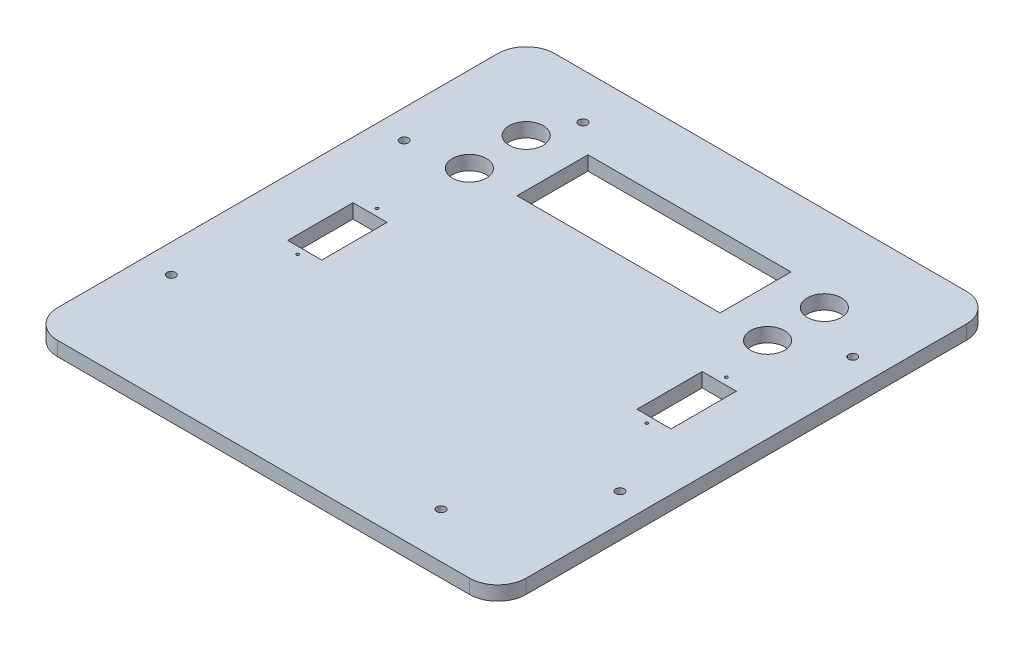
from build123d import *

# Parameters (mm, degrees)
RESSALTO_EXTRUS_O1_DEPTH = 5
ESBO_O2_R                = 1.5
CORTE_EXTRUS_O1_DEPTH    = 5
ESBO_O4_R                = 0.5
ESBO_O4_W                = 12
ESBO_O4_H                = 23
CORTE_EXTRUS_O3_DEPTH    = 193.467750623
ESBO_O5_R                = 1.5
ESBO_O5_W                = 71.5
ESBO_O5_H                = 25
CORTE_EXTRUS_O4_DEPTH    = 193.467750623
ESBO_O6_R                = 6
CORTE_EXTRUS_O5_DEPTH    = 193.467750623


with BuildPart() as part:
    # Esboço1 → Ressalto-extrusão1 (new body)
    with BuildSketch(Plane(origin=(0, 0, 0), x_dir=(1, 0, 0), z_dir=(0, 1, 0))):
        with BuildLine():
            Line((-25.463589741, 142.264378701), (119.536410259, 142.264378701))
            ThreePointArc((119.536410259, 142.264378701), (126.607478071, 139.335446513), (129.536410259, 132.264378701))
            Line((129.536410259, 132.264378701), (129.536410259, -22.735621299))
            ThreePointArc((129.536410259, -22.735621299), (126.607478071, -29.806689111), (119.536410259, -32.735621299))
            Line((119.536410259, -32.735621299), (-25.463589741, -32.735621299))
            ThreePointArc((-25.463589741, -32.735621299), (-32.534657553, -29.806689111), (-35.463589741, -22.735621299))
            Line((-35.463589741, -22.735621299), (-35.463589741, 132.264378701))
            ThreePointArc((-35.463589741, 132.264378701), (-32.534657553, 139.335446513), (-25.463589741, 142.264378701))
        make_face()
    extrude(amount=RESSALTO_EXTRUS_O1_DEPTH)

    # Esboço2 → Corte-extrusão1 (cut)
    with BuildSketch(Plane(origin=(0, 5, 0), x_dir=(1, 0, 0), z_dir=(0, 1, 0))):
        with Locations(Location((-25.463589741, 7.264378701, 0), (0, 0, 270))):
            Circle(ESBO_O2_R)
        with Locations(Location((0.536410259, 126.264378701, 0), (0, 0, 270))):
            Circle(ESBO_O2_R)
        with Locations(Location((119.536410259, 102.264378701, 0), (0, 0, 270))):
            Circle(ESBO_O2_R)
        with Locations(Location((93.536410259, -16.735621299, 0), (0, 0, 270))):
            Circle(ESBO_O2_R)
    extrude(amount=-CORTE_EXTRUS_O1_DEPTH, mode=Mode.SUBTRACT)

    # Esboço4 → Corte-extrusão3 (cut, through all)
    with BuildSketch(Plane(origin=(0, 5, 0), x_dir=(1, 0, 0), z_dir=(0, 1, 0))):
        with Locations(Location((-9.463589741, 35.764378701, 0), (0, 0, 270))):
            Circle(ESBO_O4_R)
        with Locations(Location((-9.463589741, 63.764378701, 0), (0, 0, 270))):
            Circle(ESBO_O4_R)
        with Locations(Location((103.536410259, 45.764378701, 0), (0, 0, 270))):
            Circle(ESBO_O4_R)
        with Locations(Location((103.536410259, 73.764378701, 0), (0, 0, 270))):
            Circle(ESBO_O4_R)
        with Locations((-9.463589741, 49.764378701)):
            Rectangle(ESBO_O4_W, ESBO_O4_H)
        with Locations((103.536410259, 59.764378701)):
            Rectangle(ESBO_O4_W, ESBO_O4_H)
    extrude(amount=-CORTE_EXTRUS_O3_DEPTH, mode=Mode.SUBTRACT)

    # Esboço5 → Corte-extrusão4 (cut, through all)
    with BuildSketch(Plane(origin=(0, 5, 0), x_dir=(1, 0, 0), z_dir=(0, 1, 0))):
        with Locations(Location((-25.463589741, 89.264378701, 0), (0, 0, 270))):
            Circle(ESBO_O5_R)
        with Locations(Location((119.536410259, 20.264378701, 0), (0, 0, 270))):
            Circle(ESBO_O5_R)
        with Locations((47.036410259, 104.764378701)):
            Rectangle(ESBO_O5_W, ESBO_O5_H)
    extrude(amount=-CORTE_EXTRUS_O4_DEPTH, mode=Mode.SUBTRACT)

    # Esboço6 → Corte-extrusão5 (cut, through all)
    with BuildSketch(Plane(origin=(0, 5, 0), x_dir=(1, 0, 0), z_dir=(0, 1, 0))):
        with Locations(Location((-5.463589741, 112.264378701, 0), (0, 0, 270))):
            Circle(ESBO_O6_R)
        with Locations(Location((-5.463589741, 92.264378701, 0), (0, 0, 270))):
            Circle(ESBO_O6_R)
        with Locations(Location((99.536410259, 112.264378701, 0), (0, 0, 270))):
            Circle(ESBO_O6_R)
        with Locations(Location((99.536410259, 92.264378701, 0), (0, 0, 270))):
            Circle(ESBO_O6_R)
    extrude(amount=-CORTE_EXTRUS_O5_DEPTH, mode=Mode.SUBTRACT)


solid = part.part
